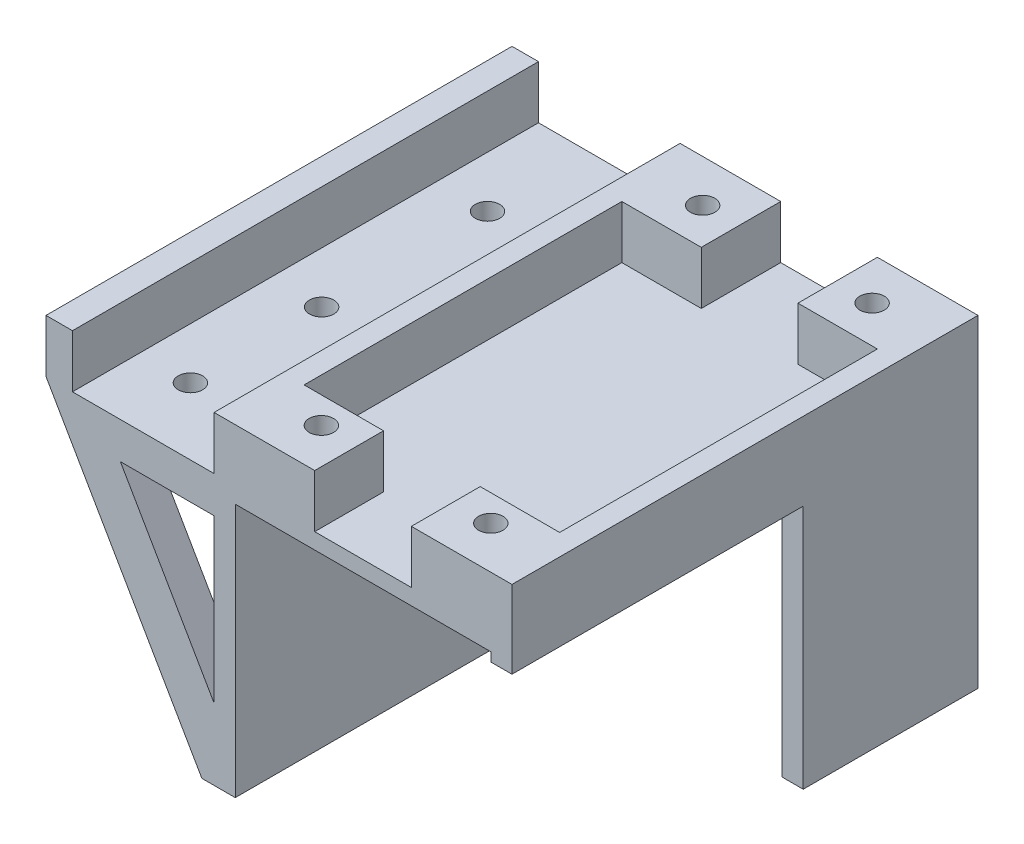
from build123d import *

# Parameters (mm, degrees)
SKETCH1_W            = 48.254
SKETCH1_H            = 3
BOSS_EXTRUDE1_DEPTH  = 70
BOSS_EXTRUDE3_DEPTH  = 8
BOSS_EXTRUDE4_DEPTH  = 8
BOSS_EXTRUDE5_DEPTH  = 8
BOSS_EXTRUDE6_DEPTH  = 70
SKETCH7_W            = 40.394634483
SKETCH7_H            = 17
CUT_EXTRUDE3_DEPTH   = 70
BOSS_EXTRUDE7_DEPTH  = 70
BOSS_EXTRUDE10_DEPTH = 8
BOSS_EXTRUDE11_DEPTH = 70
SKETCH13_W           = 83.001411072
SKETCH13_H           = 87.868559997
CUT_EXTRUDE4_DEPTH   = 4
SKETCH14_W           = 48.254
SKETCH14_H           = 10
BOSS_EXTRUDE12_DEPTH = 20
SKETCH16_W           = 56.254
SKETCH16_H           = 5
CUT_EXTRUDE5_DEPTH   = 100
SKETCH17_W           = 15
SKETCH17_H           = 15
BOSS_EXTRUDE14_DEPTH = 13
CUT_EXTRUDE8_DEPTH   = 5
SKETCH21_R           = 2.3
CUT_EXTRUDE9_DEPTH   = 15
SKETCH23_W           = 12
SKETCH23_H           = 40.530858039
CUT_EXTRUDE10_DEPTH  = 9
SKETCH25_R           = 2.3
CUT_EXTRUDE11_DEPTH  = 20
SKETCH26_R           = 2.3
CUT_EXTRUDE12_DEPTH  = 20
BOSS_EXTRUDE16_DEPTH = 20
SKETCH28_W           = 15
SKETCH28_H           = 15
BOSS_EXTRUDE17_DEPTH = 10
SKETCH29_R           = 2.3
CUT_EXTRUDE13_DEPTH  = 20
SKETCH30_W           = 10.391026801
SKETCH30_H           = 12
BOSS_EXTRUDE18_DEPTH = 5
SKETCH31_R           = 2.3
CUT_EXTRUDE14_DEPTH  = 45
SKETCH36_R           = 60.036471347
CUT_EXTRUDE15_DEPTH  = 2
SKETCH37_W           = 5
SKETCH37_H           = 88
BOSS_EXTRUDE19_DEPTH = 10
CUT_EXTRUDE16_DEPTH  = 5
SKETCH39_R           = 2.1
CUT_EXTRUDE17_DEPTH  = 5
SKETCH40_W           = 55
SKETCH40_H           = 46.30826584
CUT_EXTRUDE18_DEPTH  = 5


with BuildPart() as part:
    # Sketch1 → Boss-Extrude1 (new body)
    with BuildSketch(Plane.XY):
        Polygon((4, 0), (0, 0), (0, 70), (56.254, 70), (56.254, 0), (52.254, 0), (52.254, 65), (4, 65), align=None)
        with Locations((28.127, 53.5)):
            Rectangle(SKETCH1_W, SKETCH1_H)
    extrude(amount=BOSS_EXTRUDE1_DEPTH)

    # Sketch3 → Boss-Extrude3 (add)
    with BuildSketch(Plane.XY.offset(70)):
        Polygon((0, 62.5), (0, 70), (-40.394634483, 70), (0, 0.034440722), (0, 17.466679003), (-26, 62.5), align=None)
    extrude(amount=-BOSS_EXTRUDE3_DEPTH)

    # Sketch4 → Boss-Extrude4 (add)
    with BuildSketch(Plane(origin=(0, 0, 0), x_dir=(-1, 0, 0), z_dir=(0, 0, -1))):
        Polygon((0, 70), (40.394634483, 70), (0, 0), (0, 17.466679003), (26, 62.5), (0, 62.5), align=None)
    extrude(amount=-BOSS_EXTRUDE4_DEPTH)

    # Sketch5 → Boss-Extrude5 (add)
    with BuildSketch(Plane(origin=(0, 0, 39), x_dir=(-1, 0, 0), z_dir=(0, 0, -1))):
        Polygon((0, 62.5), (0, 70), (40.394634483, 70), (0, 0), (0, 17.466679003), (26, 62.5), align=None)
    extrude(amount=BOSS_EXTRUDE5_DEPTH)

    # Sketch6 → Boss-Extrude6 (add)
    with BuildSketch(Plane(origin=(0, 0, 0), x_dir=(-1, 0, 0), z_dir=(0, 0, -1))):
        Polygon((0, 62.5), (36.066637932, 62.5), (40.394634483, 70), (0, 70), align=None)
        Polygon((-4, 0), (0, 0), (7.50186069, 13), (-4, 13), align=None)
    extrude(amount=-BOSS_EXTRUDE6_DEPTH)

    # Sketch7 → Cut-Extrude3 (cut)
    with BuildSketch(Plane.XY.offset(70)):
        with Locations((-20.197317242, 61.5)):
            Rectangle(SKETCH7_W, SKETCH7_H)
    extrude(amount=-CUT_EXTRUDE3_DEPTH, mode=Mode.SUBTRACT)

    # Sketch8 → Boss-Extrude7 (add)
    with BuildSketch(Plane(origin=(0, 0, 0), x_dir=(-1, 0, 0), z_dir=(0, 0, -1))):
        Polygon((-4, 55), (-4, 52), (30.007442759, 52), (31.73864138, 55), align=None)
    extrude(amount=-BOSS_EXTRUDE7_DEPTH)

    # Sketch11 → Boss-Extrude10 (add)
    with BuildSketch(Plane.XY.offset(70)):
        Polygon((-31.73864138, 55), (0, 0), (-3.053687451, 13), (-27.288965695, 55), align=None)
    extrude(amount=-BOSS_EXTRUDE10_DEPTH)

    # Sketch12 → Boss-Extrude11 (add)
    with BuildSketch(Plane.XY.offset(70)):
        Polygon((-31.73864138, 55), (-27.75981023, 48.105069917), (0, 48.105069917), (0, 55), align=None)
    extrude(amount=-BOSS_EXTRUDE11_DEPTH)

    # Sketch13 → Cut-Extrude4 (cut)
    with BuildSketch(Plane.XZ):
        with Locations((25.938658228, 33.313825886)):
            Rectangle(SKETCH13_W, SKETCH13_H)
    extrude(amount=-CUT_EXTRUDE4_DEPTH, mode=Mode.SUBTRACT)

    # Sketch14 → Boss-Extrude12 (add)
    with BuildSketch(Plane.XY.offset(70)):
        Polygon((-2.308264828, 4), (-31.73864138, 55), (0, 55), (0, 70), (56.254, 70), (56.254, 4), (52.254, 4), (52.254, 52), (4, 52), (4, 4), align=None)
        Polygon((-17.689083241, 48.105069917), (0, 48.105069917), (0, 17.466679003), align=None, mode=Mode.SUBTRACT)
        with Locations((28.127, 60)):
            Rectangle(SKETCH14_W, SKETCH14_H, mode=Mode.SUBTRACT)
    extrude(amount=BOSS_EXTRUDE12_DEPTH)

    # Sketch16 → Cut-Extrude5 (cut)
    with BuildSketch(Plane.XY.offset(90)):
        with Locations((28.127, 67.5)):
            Rectangle(SKETCH16_W, SKETCH16_H)
    extrude(amount=-CUT_EXTRUDE5_DEPTH, mode=Mode.SUBTRACT)

    # Sketch17 → Boss-Extrude14 (add)
    with BuildSketch(Plane(origin=(0, 65, 0), x_dir=(1, 0, 0), z_dir=(0, 1, 0))):
        with Locations((44.754, -7.5)):
            Rectangle(SKETCH17_W, SKETCH17_H)
        with Locations((44.754, -82.5)):
            Rectangle(SKETCH17_W, SKETCH17_H)
    extrude(amount=-BOSS_EXTRUDE14_DEPTH)

    # Sketch22 → Cut-Extrude8 (cut)
    with BuildSketch(Plane.XZ.offset(-52)):
        Polygon((48.096455918, 6.003620146), (47.904143628, 10.329474511), (44.06168771, 12.325854365), (40.411544082, 9.996379854), (40.603856372, 5.670525489), (44.44631229, 3.674145635), align=None)
        Polygon((45.200685086, 75.774625774), (48.386623963, 78.707166221), (47.439938877, 82.932540447), (43.307314914, 84.225374226), (40.121376037, 81.292833779), (41.068061123, 77.067459553), align=None)
    extrude(amount=-CUT_EXTRUDE8_DEPTH, mode=Mode.SUBTRACT)

    # Sketch21 → Cut-Extrude9 (cut)
    with BuildSketch(Plane(origin=(0, 52, 0), x_dir=(-1, 0, 0), z_dir=(0, -1, 0))):
        with Locations(Location((-44.254, -80, 0), (0, 0, 90))):
            Circle(SKETCH21_R)
        with Locations(Location((-44.254, -8, 0), (0, 0, 90))):
            Circle(SKETCH21_R)
    extrude(amount=-CUT_EXTRUDE9_DEPTH, mode=Mode.SUBTRACT)

    # Sketch23 → Cut-Extrude10 (cut)
    with BuildSketch(Plane(origin=(0, 0, 0), x_dir=(0, 0, 1), z_dir=(-0.8661319205837115, -0.49981546209173167, 0))):
        with Locations((76, 35.274689955)):
            Rectangle(SKETCH23_W, SKETCH23_H)
    extrude(amount=-CUT_EXTRUDE10_DEPTH, mode=Mode.SUBTRACT)

    # Sketch25 → Cut-Extrude11 (cut)
    with BuildSketch(Plane(origin=(0, 48.105069917, 0), x_dir=(-1, 0, 0), z_dir=(0, -1, 0))):
        with Locations(Location((17.075514089, -19.30064897, 0), (0, 0, 90))):
            Circle(SKETCH25_R)
        with Locations(Location((17.075514089, -50.613733273, 0), (0, 0, 90))):
            Circle(SKETCH25_R)
    extrude(amount=-CUT_EXTRUDE11_DEPTH, mode=Mode.SUBTRACT)

    # Sketch26 → Cut-Extrude12 (cut)
    with BuildSketch(Plane.XZ.offset(-48.105069917)):
        with Locations(Location((-17.075514089, 75.391336138, 0), (0, 0, 262.674363606))):
            Circle(SKETCH26_R)
    extrude(amount=-CUT_EXTRUDE12_DEPTH, mode=Mode.SUBTRACT)

    # Sketch27 → Boss-Extrude16 (add)
    with BuildSketch(Plane.XY.offset(90)):
        Polygon((-23.310381194, 48.105069917), (-27.75981023, 48.105069917), (-31.73864138, 55), (-23.310381194, 55), align=None)
    extrude(amount=-BOSS_EXTRUDE16_DEPTH)

    # Sketch28 → Boss-Extrude17 (add)
    with BuildSketch(Plane(origin=(0, 55, 0), x_dir=(1, 0, 0), z_dir=(0, 1, 0))):
        with Locations((11.5, -7.5)):
            Rectangle(SKETCH28_W, SKETCH28_H)
        with Locations((11.5, -82.5)):
            Rectangle(SKETCH28_W, SKETCH28_H)
    extrude(amount=BOSS_EXTRUDE17_DEPTH)

    # Sketch29 → Cut-Extrude13 (cut)
    with BuildSketch(Plane(origin=(0, 52, 0), x_dir=(-1, 0, 0), z_dir=(0, -1, 0))):
        with Locations(Location((-12.254, -8, 0), (0, 0, 90))):
            Circle(SKETCH29_R)
        with Locations(Location((-12.254, -80, 0), (0, 0, 90))):
            Circle(SKETCH29_R)
    extrude(amount=-CUT_EXTRUDE13_DEPTH, mode=Mode.SUBTRACT)

    # Sketch30 → Boss-Extrude18 (add)
    with BuildSketch(Plane.XZ.offset(-48.105069917)):
        with Locations((-22.56429683, 76)):
            Rectangle(SKETCH30_W, SKETCH30_H)
    extrude(amount=-BOSS_EXTRUDE18_DEPTH)

    # Sketch31 → Cut-Extrude14 (cut)
    with BuildSketch(Plane.XZ.offset(-48.105069917)):
        with Locations(Location((-17.075514089, 75.391336138, 0), (0, 0, 270))):
            Circle(SKETCH31_R)
    extrude(amount=-CUT_EXTRUDE14_DEPTH, mode=Mode.SUBTRACT)

    # Sketch36 → Cut-Extrude15 (cut)
    with BuildSketch(Plane.XY.offset(90)):
        with Locations((23.036116276, 36.93280147)):
            Circle(SKETCH36_R)
    extrude(amount=-CUT_EXTRUDE15_DEPTH, mode=Mode.SUBTRACT)

    # Sketch37 → Boss-Extrude19 (add)
    with BuildSketch(Plane(origin=(0, 55, 0), x_dir=(1, 0, 0), z_dir=(0, 1, 0))):
        with Locations((-29.23864138, -44)):
            Rectangle(SKETCH37_W, SKETCH37_H)
    extrude(amount=BOSS_EXTRUDE19_DEPTH)

    # Sketch38 → Cut-Extrude16 (cut)
    with BuildSketch(Plane.XZ.offset(-52)):
        Polygon((12.254, 75.669872981), (16.004, 77.834936491), (16.004, 82.165063509), (12.254, 84.330127019), (8.504, 82.165063509), (8.504, 77.834936491), align=None)
        Polygon((15.567298341, 5.212159598), (16.32498978, 9.475480332), (13.011691439, 12.263320734), (8.940701659, 10.787840402), (8.18301022, 6.524519668), (11.496308561, 3.736679266), align=None)
    extrude(amount=-CUT_EXTRUDE16_DEPTH, mode=Mode.SUBTRACT)

    # Sketch39 → Cut-Extrude17 (cut)
    with BuildSketch(Plane(origin=(4, 0, 0), x_dir=(0, 0, -1), z_dir=(1, 0, 0))):
        with Locations(Location((-47.514718626, 36.485281374, 0), (0, 0, 90))):
            Circle(SKETCH39_R)
        with Locations(Location((-48, 20, 0), (0, 0, 90))):
            Circle(SKETCH39_R)
        with Locations(Location((-16.485281374, 19.514718626, 0), (0, 0, 90))):
            Circle(SKETCH39_R)
        with Locations(Location((-16.485281374, 36.485281374, 0), (0, 0, 90))):
            Circle(SKETCH39_R)
    extrude(amount=-CUT_EXTRUDE17_DEPTH, mode=Mode.SUBTRACT)

    # Sketch40 → Cut-Extrude18 (cut)
    with BuildSketch(Plane(origin=(56.254, 0, 0), x_dir=(0, 0, -1), z_dir=(1, 0, 0))):
        with Locations((-60.5, 27.15413292)):
            Rectangle(SKETCH40_W, SKETCH40_H)
    extrude(amount=-CUT_EXTRUDE18_DEPTH, mode=Mode.SUBTRACT)


solid = part.part
